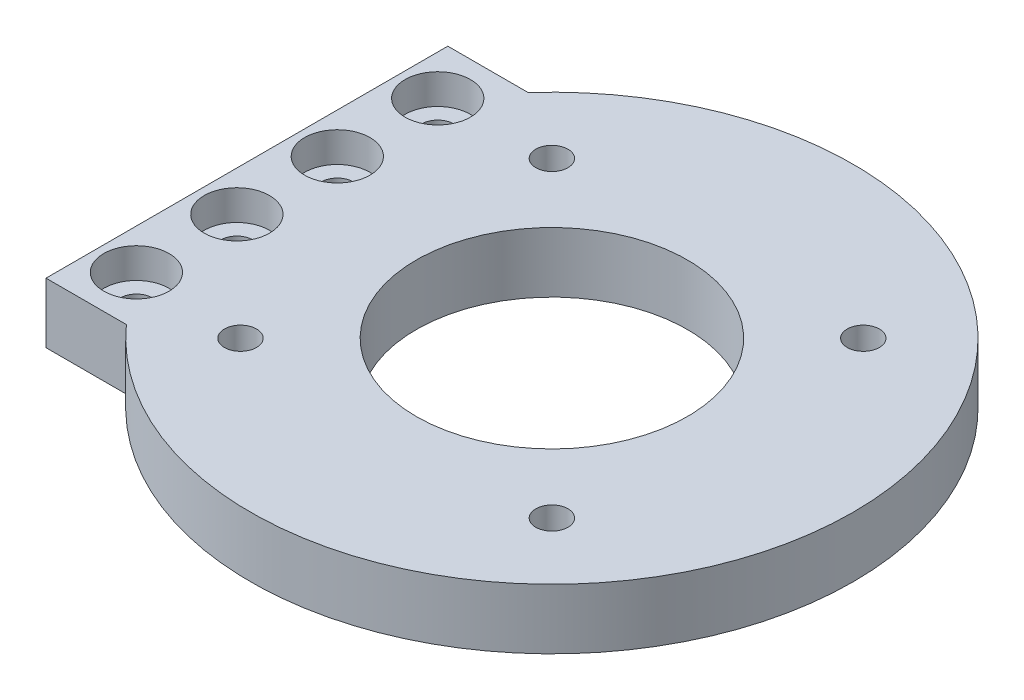
from build123d import *

# Parameters (mm, degrees)
SKETCH_1_R          = 30
SKETCH_1_R_2        = 1.6
SKETCH_1_R_3        = 13.5
EXTRUDE_1_DEPTH     = 6
SKETCH_2_W          = 8
SKETCH_2_H          = 40
EXTRUDE_2_DEPTH     = 6
SKETCH_3_R          = 1.6
CUT_EXTRUDE_1_DEPTH = 6
SKETCH_4_R          = 3.25
CUT_EXTRUDE_2_DEPTH = 3


with BuildPart() as part:
    # 草图1 → 凸台-拉伸1 (new body)
    with BuildSketch(Plane(origin=(0, 0, 0), x_dir=(1, 0, 0), z_dir=(0, 1, 0))):
        with Locations(Location((15, 90, 0), (0, 0, 270))):
            Circle(SKETCH_1_R)
        with Locations(Location((30.5, 105.5, 0), (0, 0, 270))):
            Circle(SKETCH_1_R_2, mode=Mode.SUBTRACT)
        with Locations(Location((-0.5, 105.5, 0), (0, 0, 270))):
            Circle(SKETCH_1_R_2, mode=Mode.SUBTRACT)
        with Locations(Location((15, 90, 0), (0, 0, 270))):
            Circle(SKETCH_1_R_3, mode=Mode.SUBTRACT)
        with Locations(Location((30.5, 74.5, 0), (0, 0, 270))):
            Circle(SKETCH_1_R_2, mode=Mode.SUBTRACT)
        with Locations(Location((-0.5, 74.5, 0), (0, 0, 270))):
            Circle(SKETCH_1_R_2, mode=Mode.SUBTRACT)
    extrude(amount=EXTRUDE_1_DEPTH)

    # 草图2 → 凸台-拉伸2 (add)
    with BuildSketch(Plane(origin=(0, 6, 0), x_dir=(1, 0, 0), z_dir=(0, 1, 0))):
        with Locations((-11.360679775, 90)):
            Rectangle(SKETCH_2_W, SKETCH_2_H)
    extrude(amount=-EXTRUDE_2_DEPTH)

    # 草图3 → 切除-拉伸1 (cut)
    with BuildSketch(Plane(origin=(0, 6, 0), x_dir=(1, 0, 0), z_dir=(0, 1, 0))):
        with Locations(Location((-11.360679775, 105, 0), (0, 0, 270))):
            Circle(SKETCH_3_R)
        with Locations(Location((-11.360679775, 95, 0), (0, 0, 270))):
            Circle(SKETCH_3_R)
        with Locations(Location((-11.360679775, 85, 0), (0, 0, 270))):
            Circle(SKETCH_3_R)
        with Locations(Location((-11.360679775, 75, 0), (0, 0, 270))):
            Circle(SKETCH_3_R)
    extrude(amount=-CUT_EXTRUDE_1_DEPTH, mode=Mode.SUBTRACT)

    # 草图4 → 切除-拉伸2 (cut)
    with BuildSketch(Plane(origin=(0, 6, 0), x_dir=(1, 0, 0), z_dir=(0, 1, 0))):
        with Locations(Location((-11.360679775, 105, 0), (0, 0, 270))):
            Circle(SKETCH_4_R)
        with Locations(Location((-11.360679775, 95, 0), (0, 0, 270))):
            Circle(SKETCH_4_R)
        with Locations(Location((-11.360679775, 85, 0), (0, 0, 270))):
            Circle(SKETCH_4_R)
        with Locations(Location((-11.360679775, 75, 0), (0, 0, 270))):
            Circle(SKETCH_4_R)
    extrude(amount=-CUT_EXTRUDE_2_DEPTH, mode=Mode.SUBTRACT)


solid = part.part
